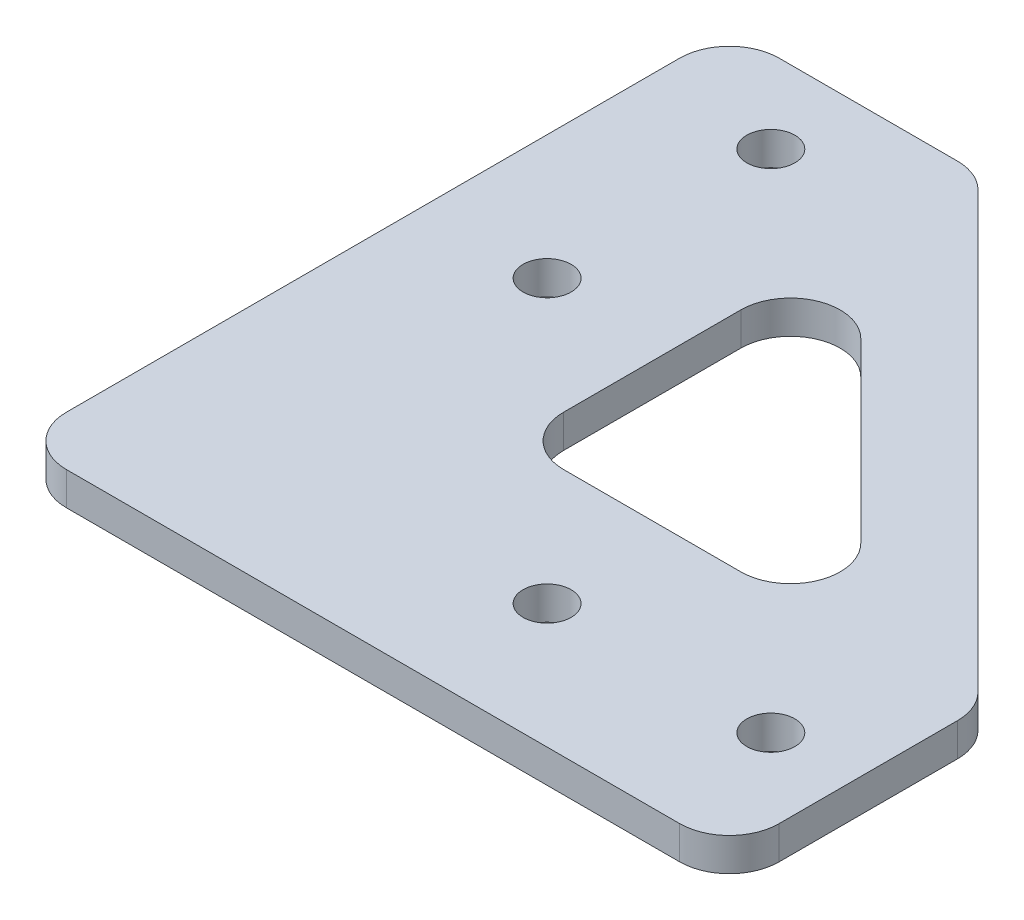
from build123d import *

# Parameters (mm, degrees)
SKETCH_1_R      = 1.45
EXTRUDE_1_DEPTH = 2
FILLET_2_R      = 3


with BuildPart() as part:
    # 草图1 → 凸台-拉伸1 (new body)
    with BuildSketch(Plane(origin=(0, 0, 0), x_dir=(1, 0, 0), z_dir=(0, 1, 0))):
        Polygon((15, 28), (43, 0), (43, -15), (0, -15), (0, 0), (0, 28), align=None)
        with Locations(Location((24.5, -7.5, 0), (0, 0, 270))):
            Circle(SKETCH_1_R, mode=Mode.SUBTRACT)
        with Locations(Location((7.5, 9.5, 0), (0, 0, 270))):
            Circle(SKETCH_1_R, mode=Mode.SUBTRACT)
        with Locations(Location((38, -7.5, 0), (0, 0, 270))):
            Circle(SKETCH_1_R, mode=Mode.SUBTRACT)
        with Locations(Location((7.5, 23, 0), (0, 0, 270))):
            Circle(SKETCH_1_R, mode=Mode.SUBTRACT)
        Polygon((15, 20.928932188), (35.928932188, 0), (15, 0), align=None, mode=Mode.SUBTRACT)
    extrude(amount=EXTRUDE_1_DEPTH)

    # 圆角2
    fillet_2_edges = [part.edges().sort_by_distance(p)[0] for p in [
        (0, 1, -28),
        (15, 1, -28),
        (43, 1, 0),
        (43, 1, 15),
        (0, 1, 15),
        (15, 1, -20.928932188),
        (15, 1, 0),
        (35.928932188, 1, 0),
    ]]
    fillet(fillet_2_edges, radius=FILLET_2_R)


solid = part.part
